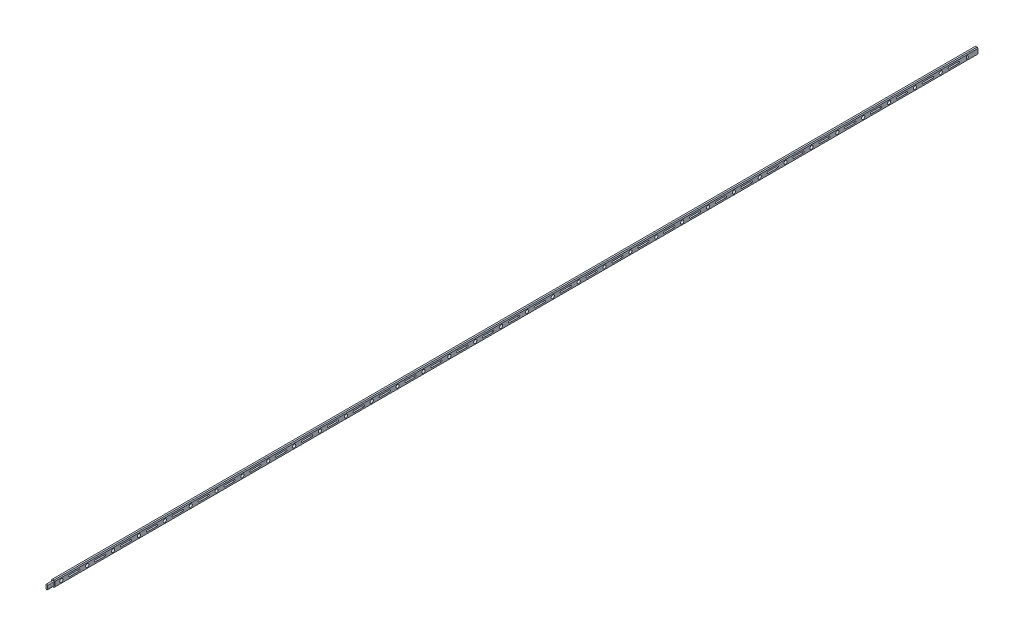
from build123d import *

# Parameters (mm, degrees)
BOSS_EXTRUDE2_DEPTH = 1816.1
BOSS_EXTRUDE3_DEPTH = 12.7
SKETCH3_R           = 1.5875
CUT_EXTRUDE1_DEPTH  = 70.358
SKETCH4_R           = 3.175
CUT_EXTRUDE2_DEPTH  = 1829.855120697
SKETCH5_W           = 255.246532101
SKETCH5_H           = 21.878216243
CUT_EXTRUDE3_DEPTH  = 254
BOSS_EXTRUDE6_DEPTH = 6.35


with BuildPart() as part:
    # Sketch1 → Boss-Extrude2 (new body)
    with BuildSketch(Plane.XY):
        Polygon((0, 11.1125), (1.5875, 12.7), (4.7625, 12.7), (6.35, 11.1125), (6.35, 1.5875), (4.7625, 0), (1.5875, 0), (0, 1.5875), align=None)
    extrude(amount=BOSS_EXTRUDE2_DEPTH)

    # Sketch2 → Boss-Extrude3 (add)
    with BuildSketch(Plane.XY.offset(1816.1)):
        with BuildLine():
            Line((4.7625, 9.525), (4.7625, 3.175))
            ThreePointArc((4.7625, 3.175), (3.175, 1.5875), (1.5875, 3.175))
            Line((1.5875, 3.175), (1.5875, 9.525))
            ThreePointArc((1.5875, 9.525), (3.175, 11.1125), (4.7625, 9.525))
        make_face()
    extrude(amount=BOSS_EXTRUDE3_DEPTH)

    # Sketch3 → Cut-Extrude1 (cut)
    with BuildSketch(Plane(origin=(6.35, 0, 0), x_dir=(0, 0, -1), z_dir=(1, 0, 0))):
        with Locations((-25.4, 6.35)):
            Circle(SKETCH3_R)
        with Locations((-76.2, 6.35)):
            Circle(SKETCH3_R)
        with Locations((-127, 6.35)):
            Circle(SKETCH3_R)
        with Locations((-177.8, 6.35)):
            Circle(SKETCH3_R)
        with Locations((-228.6, 6.35)):
            Circle(SKETCH3_R)
        with Locations((-279.4, 6.35)):
            Circle(SKETCH3_R)
        with Locations((-330.2, 6.35)):
            Circle(SKETCH3_R)
        with Locations((-381, 6.35)):
            Circle(SKETCH3_R)
        with Locations((-431.8, 6.35)):
            Circle(SKETCH3_R)
        with Locations((-482.6, 6.35)):
            Circle(SKETCH3_R)
        with Locations((-533.4, 6.35)):
            Circle(SKETCH3_R)
        with Locations((-584.2, 6.35)):
            Circle(SKETCH3_R)
        with Locations((-635, 6.35)):
            Circle(SKETCH3_R)
        with Locations((-685.8, 6.35)):
            Circle(SKETCH3_R)
        with Locations((-736.6, 6.35)):
            Circle(SKETCH3_R)
        with Locations((-787.4, 6.35)):
            Circle(SKETCH3_R)
        with Locations((-838.2, 6.35)):
            Circle(SKETCH3_R)
        with Locations((-889, 6.35)):
            Circle(SKETCH3_R)
        with Locations((-939.8, 6.35)):
            Circle(SKETCH3_R)
        with Locations((-990.6, 6.35)):
            Circle(SKETCH3_R)
        with Locations((-1041.4, 6.35)):
            Circle(SKETCH3_R)
        with Locations((-1092.2, 6.35)):
            Circle(SKETCH3_R)
        with Locations((-1143, 6.35)):
            Circle(SKETCH3_R)
        with Locations((-1193.8, 6.35)):
            Circle(SKETCH3_R)
        with Locations((-1244.6, 6.35)):
            Circle(SKETCH3_R)
        with Locations((-1295.4, 6.35)):
            Circle(SKETCH3_R)
        with Locations((-1346.2, 6.35)):
            Circle(SKETCH3_R)
        with Locations((-1397, 6.35)):
            Circle(SKETCH3_R)
        with Locations((-1447.8, 6.35)):
            Circle(SKETCH3_R)
        with Locations((-1498.6, 6.35)):
            Circle(SKETCH3_R)
        with Locations((-1549.4, 6.35)):
            Circle(SKETCH3_R)
        with Locations((-1600.2, 6.35)):
            Circle(SKETCH3_R)
        with Locations((-1651, 6.35)):
            Circle(SKETCH3_R)
        with Locations((-1701.8, 6.35)):
            Circle(SKETCH3_R)
        with Locations((-1752.6, 6.35)):
            Circle(SKETCH3_R)
        with Locations((-1803.4, 6.35)):
            Circle(SKETCH3_R)
        with BuildLine():
            Line((-41.275, 4.7625), (-60.325, 4.7625))
            ThreePointArc((-60.325, 4.7625), (-61.9125, 6.35), (-60.325, 7.9375))
            Line((-60.325, 7.9375), (-41.275, 7.9375))
            ThreePointArc((-41.275, 7.9375), (-39.6875, 6.35), (-41.275, 4.7625))
        make_face()
        with BuildLine():
            Line((-92.075, 4.7625), (-111.125, 4.7625))
            ThreePointArc((-111.125, 4.7625), (-112.7125, 6.35), (-111.125, 7.9375))
            Line((-111.125, 7.9375), (-92.075, 7.9375))
            ThreePointArc((-92.075, 7.9375), (-90.4875, 6.35), (-92.075, 4.7625))
        make_face()
        with BuildLine():
            Line((-142.875, 4.7625), (-161.925, 4.7625))
            ThreePointArc((-161.925, 4.7625), (-163.5125, 6.35), (-161.925, 7.9375))
            Line((-161.925, 7.9375), (-142.875, 7.9375))
            ThreePointArc((-142.875, 7.9375), (-141.2875, 6.35), (-142.875, 4.7625))
        make_face()
        with BuildLine():
            Line((-193.675, 4.7625), (-212.725, 4.7625))
            ThreePointArc((-212.725, 4.7625), (-214.3125, 6.35), (-212.725, 7.9375))
            Line((-212.725, 7.9375), (-193.675, 7.9375))
            ThreePointArc((-193.675, 7.9375), (-192.0875, 6.35), (-193.675, 4.7625))
        make_face()
        with BuildLine():
            Line((-244.475, 4.7625), (-263.525, 4.7625))
            ThreePointArc((-263.525, 4.7625), (-265.1125, 6.35), (-263.525, 7.9375))
            Line((-263.525, 7.9375), (-244.475, 7.9375))
            ThreePointArc((-244.475, 7.9375), (-242.8875, 6.35), (-244.475, 4.7625))
        make_face()
        with BuildLine():
            Line((-295.275, 4.7625), (-314.325, 4.7625))
            ThreePointArc((-314.325, 4.7625), (-315.9125, 6.35), (-314.325, 7.9375))
            Line((-314.325, 7.9375), (-295.275, 7.9375))
            ThreePointArc((-295.275, 7.9375), (-293.6875, 6.35), (-295.275, 4.7625))
        make_face()
        with BuildLine():
            Line((-346.075, 4.7625), (-365.125, 4.7625))
            ThreePointArc((-365.125, 4.7625), (-366.7125, 6.35), (-365.125, 7.9375))
            Line((-365.125, 7.9375), (-346.075, 7.9375))
            ThreePointArc((-346.075, 7.9375), (-344.4875, 6.35), (-346.075, 4.7625))
        make_face()
        with BuildLine():
            Line((-396.875, 4.7625), (-415.925, 4.7625))
            ThreePointArc((-415.925, 4.7625), (-417.5125, 6.35), (-415.925, 7.9375))
            Line((-415.925, 7.9375), (-396.875, 7.9375))
            ThreePointArc((-396.875, 7.9375), (-395.2875, 6.35), (-396.875, 4.7625))
        make_face()
        with BuildLine():
            Line((-447.675, 4.7625), (-466.725, 4.7625))
            ThreePointArc((-466.725, 4.7625), (-468.3125, 6.35), (-466.725, 7.9375))
            Line((-466.725, 7.9375), (-447.675, 7.9375))
            ThreePointArc((-447.675, 7.9375), (-446.0875, 6.35), (-447.675, 4.7625))
        make_face()
        with BuildLine():
            Line((-498.475, 4.7625), (-517.525, 4.7625))
            ThreePointArc((-517.525, 4.7625), (-519.1125, 6.35), (-517.525, 7.9375))
            Line((-517.525, 7.9375), (-498.475, 7.9375))
            ThreePointArc((-498.475, 7.9375), (-496.8875, 6.35), (-498.475, 4.7625))
        make_face()
        with BuildLine():
            Line((-549.275, 4.7625), (-568.325, 4.7625))
            ThreePointArc((-568.325, 4.7625), (-569.9125, 6.35), (-568.325, 7.9375))
            Line((-568.325, 7.9375), (-549.275, 7.9375))
            ThreePointArc((-549.275, 7.9375), (-547.6875, 6.35), (-549.275, 4.7625))
        make_face()
        with BuildLine():
            Line((-600.075, 4.7625), (-619.125, 4.7625))
            ThreePointArc((-619.125, 4.7625), (-620.7125, 6.35), (-619.125, 7.9375))
            Line((-619.125, 7.9375), (-600.075, 7.9375))
            ThreePointArc((-600.075, 7.9375), (-598.4875, 6.35), (-600.075, 4.7625))
        make_face()
        with BuildLine():
            Line((-650.875, 4.7625), (-669.925, 4.7625))
            ThreePointArc((-669.925, 4.7625), (-671.5125, 6.35), (-669.925, 7.9375))
            Line((-669.925, 7.9375), (-650.875, 7.9375))
            ThreePointArc((-650.875, 7.9375), (-649.2875, 6.35), (-650.875, 4.7625))
        make_face()
        with BuildLine():
            Line((-701.675, 4.7625), (-720.725, 4.7625))
            ThreePointArc((-720.725, 4.7625), (-722.3125, 6.35), (-720.725, 7.9375))
            Line((-720.725, 7.9375), (-701.675, 7.9375))
            ThreePointArc((-701.675, 7.9375), (-700.0875, 6.35), (-701.675, 4.7625))
        make_face()
        with BuildLine():
            Line((-752.475, 4.7625), (-771.525, 4.7625))
            ThreePointArc((-771.525, 4.7625), (-773.1125, 6.35), (-771.525, 7.9375))
            Line((-771.525, 7.9375), (-752.475, 7.9375))
            ThreePointArc((-752.475, 7.9375), (-750.8875, 6.35), (-752.475, 4.7625))
        make_face()
        with BuildLine():
            Line((-803.275, 4.7625), (-822.325, 4.7625))
            ThreePointArc((-822.325, 4.7625), (-823.9125, 6.35), (-822.325, 7.9375))
            Line((-822.325, 7.9375), (-803.275, 7.9375))
            ThreePointArc((-803.275, 7.9375), (-801.6875, 6.35), (-803.275, 4.7625))
        make_face()
        with BuildLine():
            Line((-854.075, 4.7625), (-873.125, 4.7625))
            ThreePointArc((-873.125, 4.7625), (-874.7125, 6.35), (-873.125, 7.9375))
            Line((-873.125, 7.9375), (-854.075, 7.9375))
            ThreePointArc((-854.075, 7.9375), (-852.4875, 6.35), (-854.075, 4.7625))
        make_face()
        with BuildLine():
            Line((-904.875, 4.7625), (-923.925, 4.7625))
            ThreePointArc((-923.925, 4.7625), (-925.5125, 6.35), (-923.925, 7.9375))
            Line((-923.925, 7.9375), (-904.875, 7.9375))
            ThreePointArc((-904.875, 7.9375), (-903.2875, 6.35), (-904.875, 4.7625))
        make_face()
        with BuildLine():
            Line((-955.675, 4.7625), (-974.725, 4.7625))
            ThreePointArc((-974.725, 4.7625), (-976.3125, 6.35), (-974.725, 7.9375))
            Line((-974.725, 7.9375), (-955.675, 7.9375))
            ThreePointArc((-955.675, 7.9375), (-954.0875, 6.35), (-955.675, 4.7625))
        make_face()
        with BuildLine():
            Line((-1006.475, 4.7625), (-1025.525, 4.7625))
            ThreePointArc((-1025.525, 4.7625), (-1027.1125, 6.35), (-1025.525, 7.9375))
            Line((-1025.525, 7.9375), (-1006.475, 7.9375))
            ThreePointArc((-1006.475, 7.9375), (-1004.8875, 6.35), (-1006.475, 4.7625))
        make_face()
        with BuildLine():
            Line((-1057.275, 4.7625), (-1076.325, 4.7625))
            ThreePointArc((-1076.325, 4.7625), (-1077.9125, 6.35), (-1076.325, 7.9375))
            Line((-1076.325, 7.9375), (-1057.275, 7.9375))
            ThreePointArc((-1057.275, 7.9375), (-1055.6875, 6.35), (-1057.275, 4.7625))
        make_face()
        with BuildLine():
            Line((-1108.075, 4.7625), (-1127.125, 4.7625))
            ThreePointArc((-1127.125, 4.7625), (-1128.7125, 6.35), (-1127.125, 7.9375))
            Line((-1127.125, 7.9375), (-1108.075, 7.9375))
            ThreePointArc((-1108.075, 7.9375), (-1106.4875, 6.35), (-1108.075, 4.7625))
        make_face()
        with BuildLine():
            Line((-1158.875, 4.7625), (-1177.925, 4.7625))
            ThreePointArc((-1177.925, 4.7625), (-1179.5125, 6.35), (-1177.925, 7.9375))
            Line((-1177.925, 7.9375), (-1158.875, 7.9375))
            ThreePointArc((-1158.875, 7.9375), (-1157.2875, 6.35), (-1158.875, 4.7625))
        make_face()
        with BuildLine():
            Line((-1209.675, 4.7625), (-1228.725, 4.7625))
            ThreePointArc((-1228.725, 4.7625), (-1230.3125, 6.35), (-1228.725, 7.9375))
            Line((-1228.725, 7.9375), (-1209.675, 7.9375))
            ThreePointArc((-1209.675, 7.9375), (-1208.0875, 6.35), (-1209.675, 4.7625))
        make_face()
        with BuildLine():
            Line((-1260.475, 4.7625), (-1279.525, 4.7625))
            ThreePointArc((-1279.525, 4.7625), (-1281.1125, 6.35), (-1279.525, 7.9375))
            Line((-1279.525, 7.9375), (-1260.475, 7.9375))
            ThreePointArc((-1260.475, 7.9375), (-1258.8875, 6.35), (-1260.475, 4.7625))
        make_face()
        with BuildLine():
            Line((-1311.275, 4.7625), (-1330.325, 4.7625))
            ThreePointArc((-1330.325, 4.7625), (-1331.9125, 6.35), (-1330.325, 7.9375))
            Line((-1330.325, 7.9375), (-1311.275, 7.9375))
            ThreePointArc((-1311.275, 7.9375), (-1309.6875, 6.35), (-1311.275, 4.7625))
        make_face()
        with BuildLine():
            Line((-1362.075, 4.7625), (-1381.125, 4.7625))
            ThreePointArc((-1381.125, 4.7625), (-1382.7125, 6.35), (-1381.125, 7.9375))
            Line((-1381.125, 7.9375), (-1362.075, 7.9375))
            ThreePointArc((-1362.075, 7.9375), (-1360.4875, 6.35), (-1362.075, 4.7625))
        make_face()
        with BuildLine():
            Line((-1412.875, 4.7625), (-1431.925, 4.7625))
            ThreePointArc((-1431.925, 4.7625), (-1433.5125, 6.35), (-1431.925, 7.9375))
            Line((-1431.925, 7.9375), (-1412.875, 7.9375))
            ThreePointArc((-1412.875, 7.9375), (-1411.2875, 6.35), (-1412.875, 4.7625))
        make_face()
        with BuildLine():
            Line((-1463.675, 4.7625), (-1482.725, 4.7625))
            ThreePointArc((-1482.725, 4.7625), (-1484.3125, 6.35), (-1482.725, 7.9375))
            Line((-1482.725, 7.9375), (-1463.675, 7.9375))
            ThreePointArc((-1463.675, 7.9375), (-1462.0875, 6.35), (-1463.675, 4.7625))
        make_face()
        with BuildLine():
            Line((-1514.475, 4.7625), (-1533.525, 4.7625))
            ThreePointArc((-1533.525, 4.7625), (-1535.1125, 6.35), (-1533.525, 7.9375))
            Line((-1533.525, 7.9375), (-1514.475, 7.9375))
            ThreePointArc((-1514.475, 7.9375), (-1512.8875, 6.35), (-1514.475, 4.7625))
        make_face()
        with BuildLine():
            Line((-1565.275, 4.7625), (-1584.325, 4.7625))
            ThreePointArc((-1584.325, 4.7625), (-1585.9125, 6.35), (-1584.325, 7.9375))
            Line((-1584.325, 7.9375), (-1565.275, 7.9375))
            ThreePointArc((-1565.275, 7.9375), (-1563.6875, 6.35), (-1565.275, 4.7625))
        make_face()
        with BuildLine():
            Line((-1616.075, 4.7625), (-1635.125, 4.7625))
            ThreePointArc((-1635.125, 4.7625), (-1636.7125, 6.35), (-1635.125, 7.9375))
            Line((-1635.125, 7.9375), (-1616.075, 7.9375))
            ThreePointArc((-1616.075, 7.9375), (-1614.4875, 6.35), (-1616.075, 4.7625))
        make_face()
        with BuildLine():
            Line((-1666.875, 4.7625), (-1685.925, 4.7625))
            ThreePointArc((-1685.925, 4.7625), (-1687.5125, 6.35), (-1685.925, 7.9375))
            Line((-1685.925, 7.9375), (-1666.875, 7.9375))
            ThreePointArc((-1666.875, 7.9375), (-1665.2875, 6.35), (-1666.875, 4.7625))
        make_face()
        with BuildLine():
            Line((-1717.675, 4.7625), (-1736.725, 4.7625))
            ThreePointArc((-1736.725, 4.7625), (-1738.3125, 6.35), (-1736.725, 7.9375))
            Line((-1736.725, 7.9375), (-1717.675, 7.9375))
            ThreePointArc((-1717.675, 7.9375), (-1716.0875, 6.35), (-1717.675, 4.7625))
        make_face()
        with BuildLine():
            Line((-1768.475, 4.7625), (-1787.525, 4.7625))
            ThreePointArc((-1787.525, 4.7625), (-1789.1125, 6.35), (-1787.525, 7.9375))
            Line((-1787.525, 7.9375), (-1768.475, 7.9375))
            ThreePointArc((-1768.475, 7.9375), (-1766.8875, 6.35), (-1768.475, 4.7625))
        make_face()
    extrude(amount=-CUT_EXTRUDE1_DEPTH, mode=Mode.SUBTRACT)

    # Sketch4 → Cut-Extrude2 (cut, through all)
    with BuildSketch(Plane.ZY):
        with Locations((1803.4, 6.35)):
            Circle(SKETCH4_R)
        with Locations((1752.6, 6.35)):
            Circle(SKETCH4_R)
        with Locations((1701.8, 6.35)):
            Circle(SKETCH4_R)
        with Locations((1651, 6.35)):
            Circle(SKETCH4_R)
        with Locations((1600.2, 6.35)):
            Circle(SKETCH4_R)
        with Locations((1549.4, 6.35)):
            Circle(SKETCH4_R)
        with Locations((1498.6, 6.35)):
            Circle(SKETCH4_R)
        with Locations((1447.8, 6.35)):
            Circle(SKETCH4_R)
        with Locations((1397, 6.35)):
            Circle(SKETCH4_R)
        with Locations((1346.2, 6.35)):
            Circle(SKETCH4_R)
        with Locations((1295.4, 6.35)):
            Circle(SKETCH4_R)
        with Locations((1244.6, 6.35)):
            Circle(SKETCH4_R)
        with Locations((1193.8, 6.35)):
            Circle(SKETCH4_R)
        with Locations((1143, 6.35)):
            Circle(SKETCH4_R)
        with Locations((1092.2, 6.35)):
            Circle(SKETCH4_R)
        with Locations((1041.4, 6.35)):
            Circle(SKETCH4_R)
        with Locations((990.6, 6.35)):
            Circle(SKETCH4_R)
        with Locations((939.8, 6.35)):
            Circle(SKETCH4_R)
        with Locations((889, 6.35)):
            Circle(SKETCH4_R)
        with Locations((838.2, 6.35)):
            Circle(SKETCH4_R)
        with Locations((787.4, 6.35)):
            Circle(SKETCH4_R)
        with Locations((736.6, 6.35)):
            Circle(SKETCH4_R)
        with Locations((685.8, 6.35)):
            Circle(SKETCH4_R)
        with Locations((635, 6.35)):
            Circle(SKETCH4_R)
        with Locations((584.2, 6.35)):
            Circle(SKETCH4_R)
        with Locations((533.4, 6.35)):
            Circle(SKETCH4_R)
        with Locations((482.6, 6.35)):
            Circle(SKETCH4_R)
        with Locations((431.8, 6.35)):
            Circle(SKETCH4_R)
        with Locations((381, 6.35)):
            Circle(SKETCH4_R)
        with Locations((330.2, 6.35)):
            Circle(SKETCH4_R)
        with Locations((279.4, 6.35)):
            Circle(SKETCH4_R)
        with Locations((228.6, 6.35)):
            Circle(SKETCH4_R)
        with Locations((177.8, 6.35)):
            Circle(SKETCH4_R)
        with Locations((127, 6.35)):
            Circle(SKETCH4_R)
        with Locations((76.2, 6.35)):
            Circle(SKETCH4_R)
        with Locations((25.4, 6.35)):
            Circle(SKETCH4_R)
    extrude(amount=-CUT_EXTRUDE2_DEPTH, mode=Mode.SUBTRACT)

    # Sketch5 → Cut-Extrude3 (cut)
    with BuildSketch(Plane(origin=(0, -6.35, 0), x_dir=(-1, 0, 0), z_dir=(0, -1, 0))):
        with Locations((69.22673395, 7.780509247)):
            Rectangle(SKETCH5_W, SKETCH5_H)
    extrude(amount=-CUT_EXTRUDE3_DEPTH, mode=Mode.SUBTRACT)

    # Sketch6 → Boss-Extrude6 (add)
    with BuildSketch(Plane.ZY):
        with BuildLine():
            Line((25.4, 9.525), (25.4, 3.175))
            ThreePointArc((25.4, 3.175), (28.575, 6.35), (25.4, 9.525))
        make_face()
    extrude(amount=-BOSS_EXTRUDE6_DEPTH)


solid = part.part
